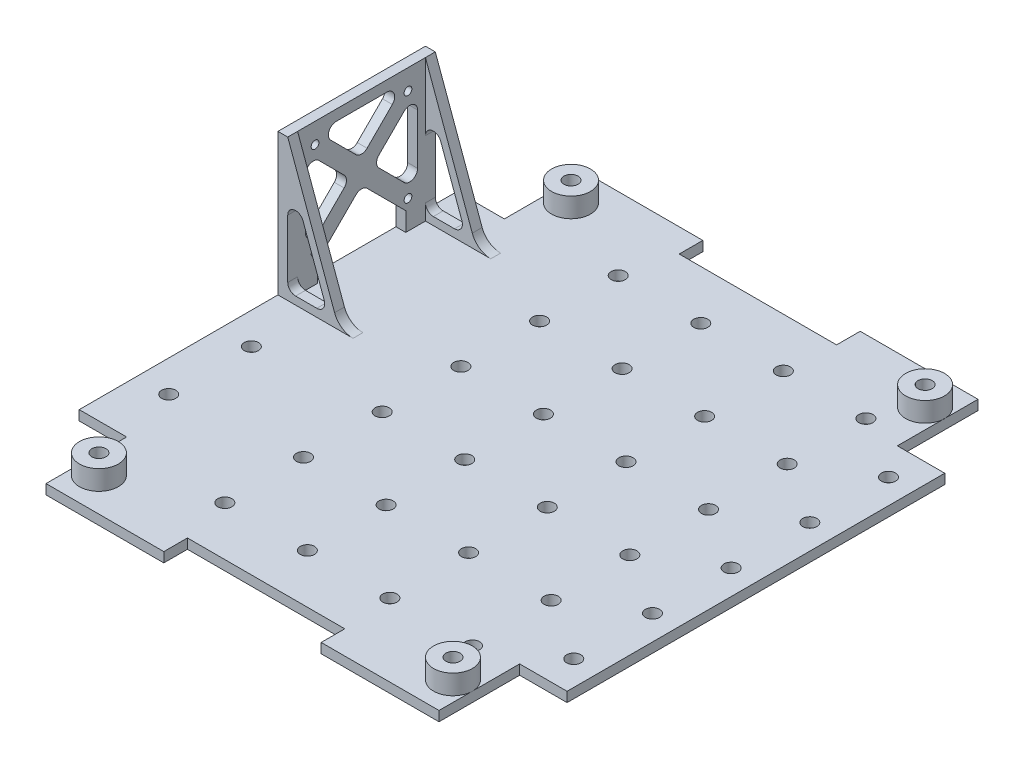
from build123d import *

# Parameters (mm, degrees)
SKETCH1_R            = 2.286
MAIN_BODY_DEPTH      = 3.175
SKETCH34_W           = 7.62
SKETCH34_H           = 50.8
BOSS_EXTRUDE3_DEPTH  = 3.175
SKETCH35_R           = 6.28142
SKETCH35_R_2         = 2.286
BOSS_EXTRUDE4_DEPTH  = 6.35
SKETCH37_W           = 3.175
SKETCH37_H           = 47.625
BOSS_EXTRUDE5_DEPTH  = 45.72
SKETCH40_R           = 1.25
CUT_EXTRUDE3_DEPTH   = 3.175
CUT_EXTRUDE6_REACH   = 188.437
SKETCH48_W           = 28.575
SKETCH48_H           = 6.0825
SKETCH49_R           = 2.286
CUT_EXTRUDE7_DEPTH   = 126.930282399
EXTRUDE_THIN1_DEPTH  = 3.175
FILLET1_R            = 2.54
FILLET2_R            = 6.35
FILLET1_OF_MIRROR2_R = 2.54
FILLET2_OF_MIRROR2_R = 6.35
SKETCH50_R           = 2.286
CUT_EXTRUDE8_DEPTH   = 126.930282399


with BuildPart() as part:
    # Sketch1 → Main Body (new body)
    with BuildSketch(Plane(origin=(0, 0, 0), x_dir=(1, 0, 0), z_dir=(0, 1, 0))):
        Polygon((-25.4, 86.995), (-63.43142, 86.995), (-63.43142, 60.96), (-78.74, 60.96), (-78.74, 25.4), (-71.12, 25.4), (-71.12, -25.4), (-78.74, -25.4), (-78.74, -60.96), (-63.43142, -60.96), (-63.43142, -86.995), (-25.4, -86.995), (-25.4, -79.375), (25.4, -79.375), (25.4, -86.995), (63.43142, -86.995), (63.43142, -60.96), (78.74, -60.96), (78.74, -25.4), (71.12, -25.4), (71.12, 25.4), (78.74, 25.4), (78.74, 60.96), (63.43142, 60.96), (63.43142, 86.995), (25.4, 86.995), (25.4, 79.375), (-25.4, 79.375), align=None)
        with Locations(Location((-57.15, 76.2, 0), (0, 0, 270))):
            Circle(SKETCH1_R, mode=Mode.SUBTRACT)
        with Locations(Location((57.15, 76.2, 0), (0, 0, 270))):
            Circle(SKETCH1_R, mode=Mode.SUBTRACT)
        with Locations(Location((57.15, -76.2, 0), (0, 0, 270))):
            Circle(SKETCH1_R, mode=Mode.SUBTRACT)
        with Locations(Location((-57.15, -76.2, 0), (0, 0, 270))):
            Circle(SKETCH1_R, mode=Mode.SUBTRACT)
    extrude(amount=MAIN_BODY_DEPTH)

    # Sketch34 → Boss-Extrude3 (add)
    with BuildSketch(Plane(origin=(0, 3.175, 0), x_dir=(1, 0, 0), z_dir=(0, 1, 0))):
        with Locations((-74.93, 0)):
            Rectangle(SKETCH34_W, SKETCH34_H)
        with Locations((74.93, 0)):
            Rectangle(SKETCH34_W, SKETCH34_H)
    extrude(amount=-BOSS_EXTRUDE3_DEPTH)

    # Sketch35 → Boss-Extrude4 (add)
    # profile 1 of 4: a face of its own
    with BuildSketch(Plane(origin=(0, 3.175, 0), x_dir=(1, 0, 0), z_dir=(0, 1, 0))):
        with Locations((57.15, 76.2)):
            Circle(SKETCH35_R)
        with Locations(Location((57.15, 76.2, 0), (0, 0, 270))):
            Circle(SKETCH35_R_2, mode=Mode.SUBTRACT)
    # profile 2 of 4: a face of its own
    with BuildSketch(Plane(origin=(0, 3.175, 0), x_dir=(1, 0, 0), z_dir=(0, 1, 0))):
        with Locations((57.15, -76.2)):
            Circle(SKETCH35_R)
        with Locations(Location((57.15, -76.2, 0), (0, 0, 270))):
            Circle(SKETCH35_R_2, mode=Mode.SUBTRACT)
    # profile 3 of 4: a face of its own
    with BuildSketch(Plane(origin=(0, 3.175, 0), x_dir=(1, 0, 0), z_dir=(0, 1, 0))):
        with Locations(Location((-57.15, -76.2, 0), (0, 0, 180))):
            Circle(SKETCH35_R)
        with Locations(Location((-57.15, -76.2, 0), (0, 0, 270))):
            Circle(SKETCH35_R_2, mode=Mode.SUBTRACT)
    # profile 4 of 4: a face of its own
    with BuildSketch(Plane(origin=(0, 3.175, 0), x_dir=(1, 0, 0), z_dir=(0, 1, 0))):
        with Locations(Location((-57.15, 76.2, 0), (0, 0, 180))):
            Circle(SKETCH35_R)
        with Locations(Location((-57.15, 76.2, 0), (0, 0, 270))):
            Circle(SKETCH35_R_2, mode=Mode.SUBTRACT)
    extrude(amount=BOSS_EXTRUDE4_DEPTH)

    # Sketch37 → Boss-Extrude5 (add)
    with BuildSketch(Plane(origin=(0, 3.175, 0), x_dir=(1, 0, 0), z_dir=(0, 1, 0))):
        with Locations((-77.1525, 26.9875)):
            Rectangle(SKETCH37_W, SKETCH37_H)
    extrude(amount=BOSS_EXTRUDE5_DEPTH)

    # Sketch40 → Cut-Extrude3 (cut)
    with BuildSketch(Plane.ZY.offset(78.74)):
        with Locations((-41.9875, 42.355)):
            Circle(SKETCH40_R)
        with Locations((-11.9875, 42.355)):
            Circle(SKETCH40_R)
        with Locations((-11.9875, 12.355)):
            Circle(SKETCH40_R)
        with Locations((-41.9875, 12.355)):
            Circle(SKETCH40_R)
        with BuildLine():
            Line((-35.142897552, 45.4525), (-18.832102448, 45.4525))
            ThreePointArc((-18.832102448, 45.4525), (-16.485448436, 43.884515918), (-17.036051224, 41.116448776))
            Line((-17.036051224, 41.116448776), (-25.191448776, 32.961051224))
            ThreePointArc((-25.191448776, 32.961051224), (-26.9875, 32.217102448), (-28.783551224, 32.961051224))
            Line((-28.783551224, 32.961051224), (-36.938948776, 41.116448776))
            ThreePointArc((-36.938948776, 41.116448776), (-37.489551564, 43.884515918), (-35.142897552, 45.4525))
        make_face()
        with BuildLine():
            Line((-21.381448776, 29.151051224), (-13.226051224, 37.306448776))
            ThreePointArc((-13.226051224, 37.306448776), (-10.457984082, 37.857051564), (-8.89, 35.510397552))
            Line((-8.89, 35.510397552), (-8.89, 19.199602448))
            ThreePointArc((-8.89, 19.199602448), (-10.457984082, 16.852948436), (-13.226051224, 17.403551224))
            Line((-13.226051224, 17.403551224), (-21.381448776, 25.558948776))
            ThreePointArc((-21.381448776, 25.558948776), (-22.125397552, 27.355), (-21.381448776, 29.151051224))
        make_face()
        with BuildLine():
            Line((-25.191448776, 21.748948776), (-12.7, 9.2575))
            Line((-12.7, 9.2575), (-41.275, 9.2575))
            Line((-41.275, 9.2575), (-28.783551224, 21.748948776))
            ThreePointArc((-28.783551224, 21.748948776), (-26.9875, 22.492897552), (-25.191448776, 21.748948776))
        make_face()
        with BuildLine():
            Line((-32.593551224, 25.558948776), (-40.748948776, 17.403551224))
            ThreePointArc((-40.748948776, 17.403551224), (-43.517015918, 16.852948436), (-45.085, 19.199602448))
            Line((-45.085, 19.199602448), (-45.085, 35.510397552))
            ThreePointArc((-45.085, 35.510397552), (-43.517015918, 37.857051564), (-40.748948776, 37.306448776))
            Line((-40.748948776, 37.306448776), (-32.593551224, 29.151051224))
            ThreePointArc((-32.593551224, 29.151051224), (-31.849602448, 27.355), (-32.593551224, 25.558948776))
        make_face()
    extrude(amount=-CUT_EXTRUDE3_DEPTH, mode=Mode.SUBTRACT)

    # Sketch48 → Cut-Extrude6 (cut, up to next)
    with BuildSketch(Plane.ZY.offset(78.74), mode=Mode.PRIVATE) as cut_extrude6_sk1:
        with Locations((-26.9875, 6.21625)):
            Rectangle(SKETCH48_W, SKETCH48_H)
    cut_extrude6_tool1 = extrude(cut_extrude6_sk1.sketch, amount=-CUT_EXTRUDE6_REACH, mode=Mode.PRIVATE) & part.part
    add(cut_extrude6_tool1.solids().sort_by_distance((-78.74, 6.21625, -26.9875))[0], mode=Mode.SUBTRACT)

    # Sketch49 → Cut-Extrude7 (cut, through all)
    with BuildSketch(Plane(origin=(0, 3.175, 0), x_dir=(1, 0, 0), z_dir=(0, 1, 0))):
        with Locations(Location((-68.58, -15.5575, 0), (0, 0, 270))):
            Circle(SKETCH49_R)
        with Locations(Location((-68.58, -42.2275, 0), (0, 0, 270))):
            Circle(SKETCH49_R)
    extrude(amount=-CUT_EXTRUDE7_DEPTH, mode=Mode.SUBTRACT)

    # Sketch39 → Extrude-Thin1 (add)
    with BuildSketch(Plane.XY.offset(-3.175)):
        Polygon((-75.565, 48.895), (-58.924280889, 3.175), (-75.565, 3.175), (-75.565, 5.715), (-62.551776826, 5.715), (-77.951819257, 48.026268836), align=None)
    extrude_thin1 = extrude(amount=-EXTRUDE_THIN1_DEPTH)

    # Fillet1
    fillet1_edges = [part.edges().sort_by_distance(p)[0] for p in [
        (-75.565, 5.715, -4.7625),
        (-75.565, 41.468536824, -4.7625),
        (-62.551776826, 5.715, -4.7625),
    ]]
    fillet(fillet1_edges, radius=FILLET1_R)

    # Fillet2
    fillet2_edges = [part.edges().sort_by_distance(p)[0] for p in [
        (-58.924280889, 3.175, -4.7625),
    ]]
    fillet(fillet2_edges, radius=FILLET2_R)

    # Mirror2: Extrude-Thin1 across plane
    add(extrude_thin1.mirror(Plane(origin=(0, 0, -26.9875), x_dir=(1, 0, 0), z_dir=(0, 0, -1))))

    # Fillet1 of Mirror2
    fillet1_of_mirror2_edges = [part.edges().sort_by_distance(p)[0] for p in [
        (-75.565, 5.715, -49.2125),
        (-75.565, 41.468536824, -49.2125),
        (-62.551776826, 5.715, -49.2125),
    ]]
    fillet(fillet1_of_mirror2_edges, radius=FILLET1_OF_MIRROR2_R)

    # Fillet2 of Mirror2
    fillet2_of_mirror2_edges = [part.edges().sort_by_distance(p)[0] for p in [
        (-58.924280889, 3.175, -49.2125),
    ]]
    fillet(fillet2_of_mirror2_edges, radius=FILLET2_OF_MIRROR2_R)

    # Sketch50 → Cut-Extrude8 (cut, through all)
    with BuildSketch(Plane(origin=(0, 3.175, 0), x_dir=(1, 0, 0), z_dir=(0, 1, 0))):
        with Locations(Location((-29.21, 63.5, 0), (0, 0, 270))):
            Circle(SKETCH50_R)
        with Locations(Location((-2.56286, 63.5, 0), (0, 0, 270))):
            Circle(SKETCH50_R)
        with Locations(Location((24.08428, 63.5, 0), (0, 0, 270))):
            Circle(SKETCH50_R)
        with Locations(Location((50.73142, 63.5, 0), (0, 0, 270))):
            Circle(SKETCH50_R)
        with Locations(Location((-2.56286, 38.1, 0), (0, 0, 270))):
            Circle(SKETCH50_R)
        with Locations(Location((24.08428, 38.1, 0), (0, 0, 270))):
            Circle(SKETCH50_R)
        with Locations(Location((50.73142, 38.1, 0), (0, 0, 270))):
            Circle(SKETCH50_R)
        with Locations(Location((-2.56286, 12.7, 0), (0, 0, 270))):
            Circle(SKETCH50_R)
        with Locations(Location((24.08428, 12.7, 0), (0, 0, 270))):
            Circle(SKETCH50_R)
        with Locations(Location((50.73142, 12.7, 0), (0, 0, 270))):
            Circle(SKETCH50_R)
        with Locations(Location((-2.56286, -12.7, 0), (0, 0, 270))):
            Circle(SKETCH50_R)
        with Locations(Location((24.08428, -12.7, 0), (0, 0, 270))):
            Circle(SKETCH50_R)
        with Locations(Location((50.73142, -12.7, 0), (0, 0, 270))):
            Circle(SKETCH50_R)
        with Locations(Location((-2.56286, -38.1, 0), (0, 0, 270))):
            Circle(SKETCH50_R)
        with Locations(Location((24.08428, -38.1, 0), (0, 0, 270))):
            Circle(SKETCH50_R)
        with Locations(Location((50.73142, -38.1, 0), (0, 0, 270))):
            Circle(SKETCH50_R)
        with Locations(Location((-2.56286, -63.5, 0), (0, 0, 270))):
            Circle(SKETCH50_R)
        with Locations(Location((24.08428, -63.5, 0), (0, 0, 270))):
            Circle(SKETCH50_R)
        with Locations(Location((50.73142, -63.5, 0), (0, 0, 270))):
            Circle(SKETCH50_R)
        with Locations(Location((-29.21, 38.1, 0), (0, 0, 270))):
            Circle(SKETCH50_R)
        with Locations(Location((-29.21, 12.7, 0), (0, 0, 270))):
            Circle(SKETCH50_R)
        with Locations(Location((-29.21, -12.7, 0), (0, 0, 270))):
            Circle(SKETCH50_R)
        with Locations(Location((-29.21, -38.1, 0), (0, 0, 270))):
            Circle(SKETCH50_R)
        with Locations(Location((-29.21, -63.5, 0), (0, 0, 270))):
            Circle(SKETCH50_R)
        with Locations(Location((70.73392, 50.8, 0), (0, 0, 270))):
            Circle(SKETCH50_R)
        with Locations(Location((70.73392, 25.4, 0), (0, 0, 270))):
            Circle(SKETCH50_R)
        with Locations(Location((70.73392, 0, 0), (0, 0, 270))):
            Circle(SKETCH50_R)
        with Locations(Location((70.73392, -25.4, 0), (0, 0, 270))):
            Circle(SKETCH50_R)
        with Locations(Location((70.73392, -50.8, 0), (0, 0, 270))):
            Circle(SKETCH50_R)
    extrude(amount=-CUT_EXTRUDE8_DEPTH, mode=Mode.SUBTRACT)


solid = part.part
